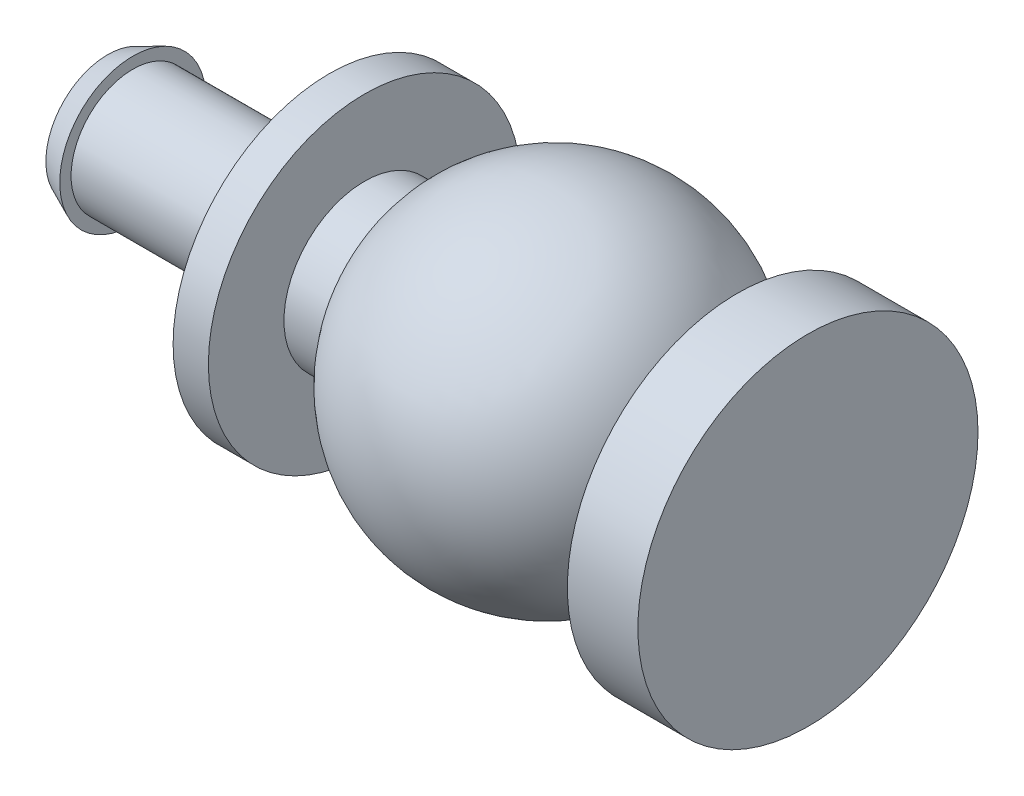
from build123d import *

# Parameters (mm, degrees)
IZIM6_R               = 1.25
KES_EKSTR_ZYON1_DEPTH = 4


with BuildPart() as part:
    # Çizim5 → Döndür1 (revolve)
    with BuildSketch(Plane(origin=(0, 0, 0), x_dir=(1, 0, 0), z_dir=(0, 1, 0)), mode=Mode.PRIVATE) as d_nd_r1_sk:
        with BuildLine():
            Line((0, 0), (0, -2.45))
            Line((0, -2.45), (1, -2.9))
            Line((1, -2.9), (1, -2.45))
            Line((1, -2.45), (6.8, -2.45))
            Line((6.8, -2.45), (8.8, -6.2))
            Line((8.8, -6.2), (10.2, -6.2))
            Line((10.2, -6.2), (10.2, -3.2))
            Line((10.2, -3.2), (11.85, -3.2))
            ThreePointArc((11.85, -3.2), (17.6, -6.75), (23.35, -3.2))
            Line((23.35, -3.2), (25, -3.2))
            Line((25, -3.2), (25, -6.75))
            Line((25, -6.75), (27.8, -6.75))
            Line((27.8, -6.75), (27.8, 0))
            Line((27.8, 0), (0, 0))
        make_face()
    revolve(d_nd_r1_sk.sketch.rotate(Axis((27.8, 0, 0), (-1, 0, 0)), 180), axis=Axis((27.8, 0, 0), (-1, 0, 0)))

    # Çizim6 → Kes-Ekstrüzyon1 (cut)
    with BuildSketch(Plane.ZY):
        Circle(IZIM6_R)
    extrude(amount=-KES_EKSTR_ZYON1_DEPTH, mode=Mode.SUBTRACT)


solid = part.part
